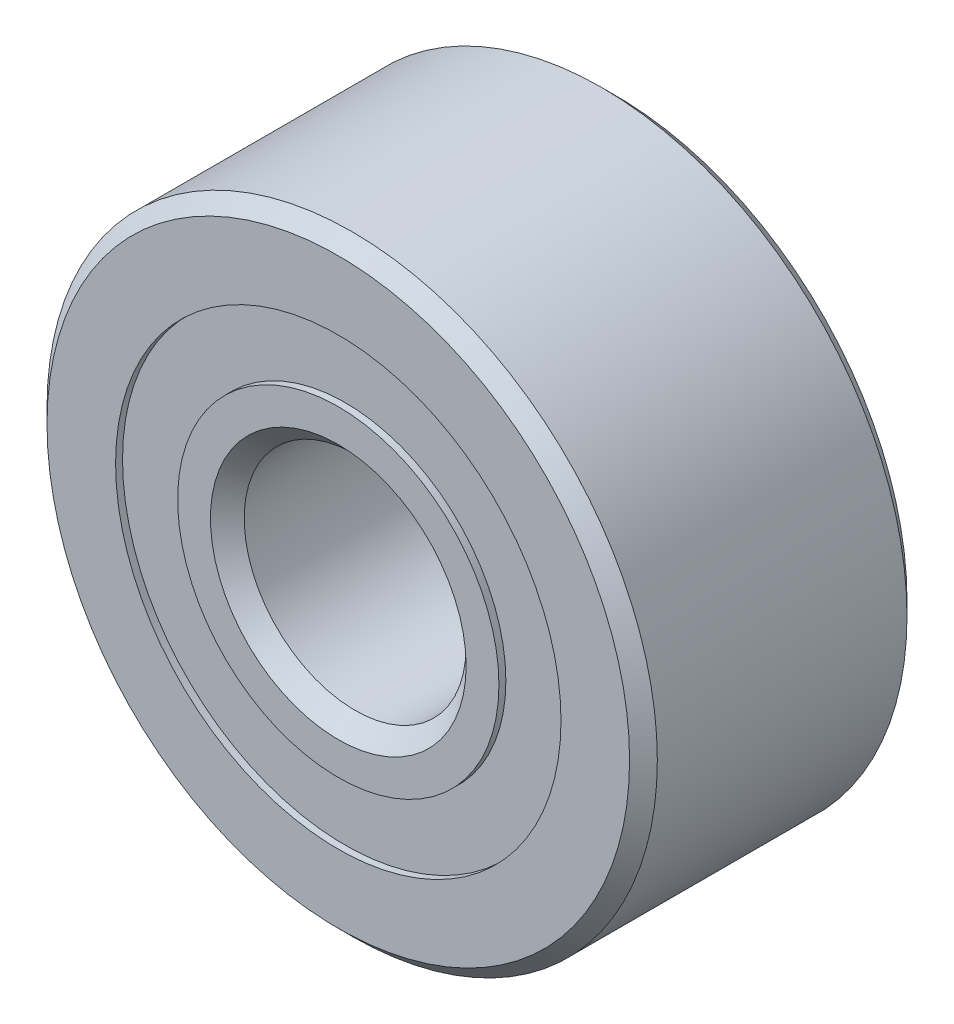
from build123d import *

# Parameters (mm, degrees)
CIRPATTERN1_COUNT = 8
SKETCH5_W         = 1.957414803
SKETCH5_H         = 1.775777653


with BuildPart() as part:
    # Sketch1 → Revolve1 (revolve)
    with BuildSketch(Plane(origin=(0, 0, 0), x_dir=(0, 0, -1), z_dir=(1, 0, 0))):
        with BuildLine():
            Line((3.571875, 8.73125), (-3.571875, 8.73125))
            Line((-3.571875, 8.73125), (-3.96875, 8.334375))
            Line((-3.96875, 8.334375), (-3.96875, 6.371806319))
            Line((-3.96875, 6.371806319), (-1.763888889, 6.371806319))
            ThreePointArc((-1.763888889, 6.371806319), (0, 7.766022697), (1.763888889, 6.371806319))
            Line((1.763888889, 6.371806319), (3.96875, 6.371806319))
            Line((3.96875, 6.371806319), (3.96875, 8.334375))
            Line((3.96875, 8.334375), (3.571875, 8.73125))
        make_face()
    revolve(axis=Axis((0, 0, 3.96875), (0, 0, -1)))


with BuildPart() as body_2:
    # Sketch3 → Revolve3 (revolve)
    with BuildSketch(Plane(origin=(0, 0, 0), x_dir=(0, 0, -1), z_dir=(1, 0, 0))):
        with BuildLine():
            Line((-3.7703125, 4.397591166), (-3.030334985, 3.657613652))
            Line((-3.030334985, 3.657613652), (0, 3.657613652))
            Line((0, 3.657613652), (0, 4.140227303))
            ThreePointArc((0, 4.140227303), (1.124182294, 4.530868965), (1.763888889, 5.534443681))
            Line((1.763888889, 5.534443681), (3.96875, 5.534443681))
            Line((3.96875, 5.534443681), (3.96875, 3.571875))
            Line((3.96875, 3.571875), (3.571875, 3.175))
            Line((3.571875, 3.175), (-3.486136348, 3.175))
            Line((-3.486136348, 3.175), (-3.96875, 3.657613652))
            Line((-3.96875, 3.657613652), (-3.96875, 4.596028666))
            Line((-3.96875, 4.596028666), (-3.7703125, 4.596028666))
            Line((-3.7703125, 4.596028666), (-3.7703125, 4.397591166))
        make_face()
    revolve(axis=Axis((0, 0, 3.96875), (0, 0, -1)))


with BuildPart() as body_3:
    # Sketch4 → Revolve4 (revolve)
    with BuildSketch(Plane(origin=(0, 0, 0), x_dir=(0, 0, -1), z_dir=(1, 0, 0))):
        with BuildLine():
            Line((-1.812897697, 5.953125), (1.812897697, 5.953125))
            ThreePointArc((1.812897697, 5.953125), (0, 7.766022697), (-1.812897697, 5.953125))
        make_face()
    revolve(axis=Axis((0, 5.953125, 1.812897697), (0, 0, -1)))


with BuildPart() as cirpattern1_1:
    # CirPattern1: pattern copy
    add(body_3.part.rotate(Axis((0, 0, -3.96875), (0, 0, 1)), 1 * 360 / CIRPATTERN1_COUNT))


with BuildPart() as cirpattern1_2:
    # CirPattern1: pattern copy
    add(body_3.part.rotate(Axis((0, 0, -3.96875), (0, 0, 1)), 2 * 360 / CIRPATTERN1_COUNT))


with BuildPart() as cirpattern1_3:
    # CirPattern1: pattern copy
    add(body_3.part.rotate(Axis((0, 0, -3.96875), (0, 0, 1)), 3 * 360 / CIRPATTERN1_COUNT))


with BuildPart() as cirpattern1_4:
    # CirPattern1: pattern copy
    add(body_3.part.rotate(Axis((0, 0, -3.96875), (0, 0, 1)), 4 * 360 / CIRPATTERN1_COUNT))


with BuildPart() as cirpattern1_5:
    # CirPattern1: pattern copy
    add(body_3.part.rotate(Axis((0, 0, -3.96875), (0, 0, 1)), 5 * 360 / CIRPATTERN1_COUNT))


with BuildPart() as cirpattern1_6:
    # CirPattern1: pattern copy
    add(body_3.part.rotate(Axis((0, 0, -3.96875), (0, 0, 1)), 6 * 360 / CIRPATTERN1_COUNT))


with BuildPart() as cirpattern1_7:
    # CirPattern1: pattern copy
    add(body_3.part.rotate(Axis((0, 0, -3.96875), (0, 0, 1)), 7 * 360 / CIRPATTERN1_COUNT))


with BuildPart() as body_11:
    # Sketch5 → Revolve5 (revolve)
    with BuildSketch(Plane(origin=(0, 0, 0), x_dir=(0, 0, -1), z_dir=(1, 0, 0))):
        with Locations((-2.791605099, 5.483917492)):
            Rectangle(SKETCH5_W, SKETCH5_H)
        with Locations((2.791605099, 5.483917492)):
            Rectangle(SKETCH5_W, SKETCH5_H)
    revolve(axis=Axis((0, 0, 3.96875), (0, 0, -1)))


solid = Compound([part.part, body_2.part, body_3.part, cirpattern1_1.part, cirpattern1_2.part, cirpattern1_3.part, cirpattern1_4.part, cirpattern1_5.part, cirpattern1_6.part, cirpattern1_7.part, body_11.part])
